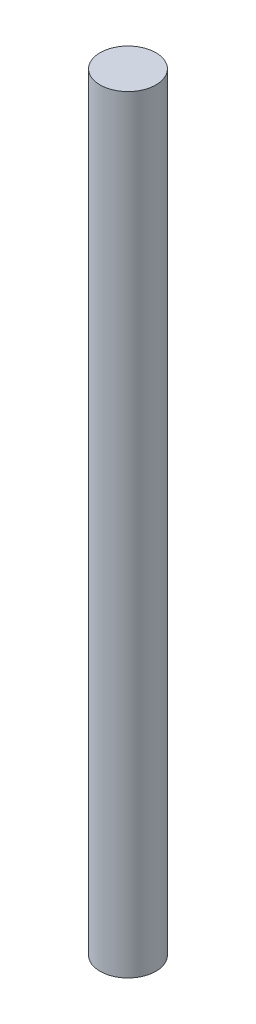
from build123d import *

# Parameters (mm, degrees)
SKETCH1_R           = 4
BOSS_EXTRUDE1_DEPTH = 110


with BuildPart() as part:
    # Sketch1 → Boss-Extrude1 (new body)
    with BuildSketch(Plane(origin=(0, 0, 0), x_dir=(1, 0, 0), z_dir=(0, 1, 0))):
        with Locations(Location((0, 0, 0), (0, 0, 270))):
            Circle(SKETCH1_R)
    extrude(amount=BOSS_EXTRUDE1_DEPTH)


solid = part.part
